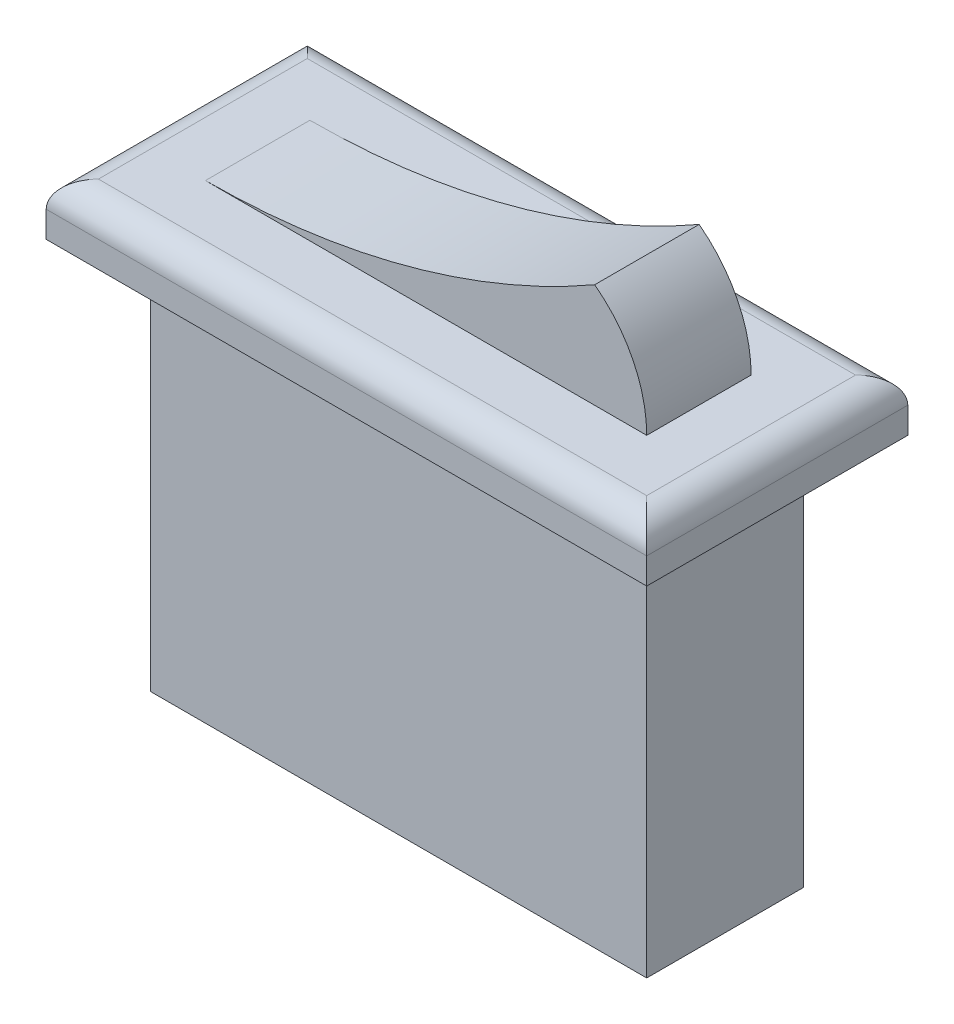
from build123d import *

# Parameters (mm, degrees)
SKETCH1_W           = 19
SKETCH1_H           = 6
BOSS_EXTRUDE1_DEPTH = 15
SKETCH2_W           = 23
SKETCH2_H           = 10
BOSS_EXTRUDE2_DEPTH = 2
SKETCH3_W           = 17
SKETCH3_H           = 4
BOSS_EXTRUDE3_DEPTH = 4
CUT_EXTRUDE1_DEPTH  = 4
FILLET1_R           = 1


with BuildPart() as part:
    # Sketch1 → Boss-Extrude1 (new body)
    with BuildSketch(Plane(origin=(0, 0, 0), x_dir=(1, 0, 0), z_dir=(0, 1, 0))):
        with Locations((-9.5, 3)):
            Rectangle(SKETCH1_W, SKETCH1_H)
    extrude(amount=BOSS_EXTRUDE1_DEPTH)

    # Sketch2 → Boss-Extrude2 (add)
    with BuildSketch(Plane(origin=(0, 15, 0), x_dir=(1, 0, 0), z_dir=(0, 1, 0))):
        with Locations((-9.5, 3)):
            Rectangle(SKETCH2_W, SKETCH2_H)
    extrude(amount=BOSS_EXTRUDE2_DEPTH)

    # Sketch3 → Boss-Extrude3 (add)
    with BuildSketch(Plane(origin=(0, 17, 0), x_dir=(1, 0, 0), z_dir=(0, 1, 0))):
        with Locations((-9.5, 3)):
            Rectangle(SKETCH3_W, SKETCH3_H)
    extrude(amount=BOSS_EXTRUDE3_DEPTH)

    # Sketch4 → Cut-Extrude1 (cut)
    with BuildSketch(Plane(origin=(0, 0, -5), x_dir=(-1, 0, 0), z_dir=(0, 0, -1))):
        with BuildLine():
            Line((1, 21), (1, 17))
            ThreePointArc((1, 17), (1.525373828, 19.234142662), (2.991374837, 21))
            Line((2.991374837, 21), (1, 21))
        make_face()
        with BuildLine():
            ThreePointArc((2.991374837, 21), (10.232075784, 18.010887947), (18, 17))
            Line((18, 17), (18, 21))
            Line((18, 21), (2.991374837, 21))
        make_face()
    extrude(amount=-CUT_EXTRUDE1_DEPTH, mode=Mode.SUBTRACT)

    # Fillet1
    fillet1_edges = [part.edges().sort_by_distance(p)[0] for p in [
        (-21, 17, -3),
        (-9.5, 17, 2),
        (2, 17, -3),
        (-9.5, 17, -8),
    ]]
    fillet(fillet1_edges, radius=FILLET1_R)


solid = part.part
